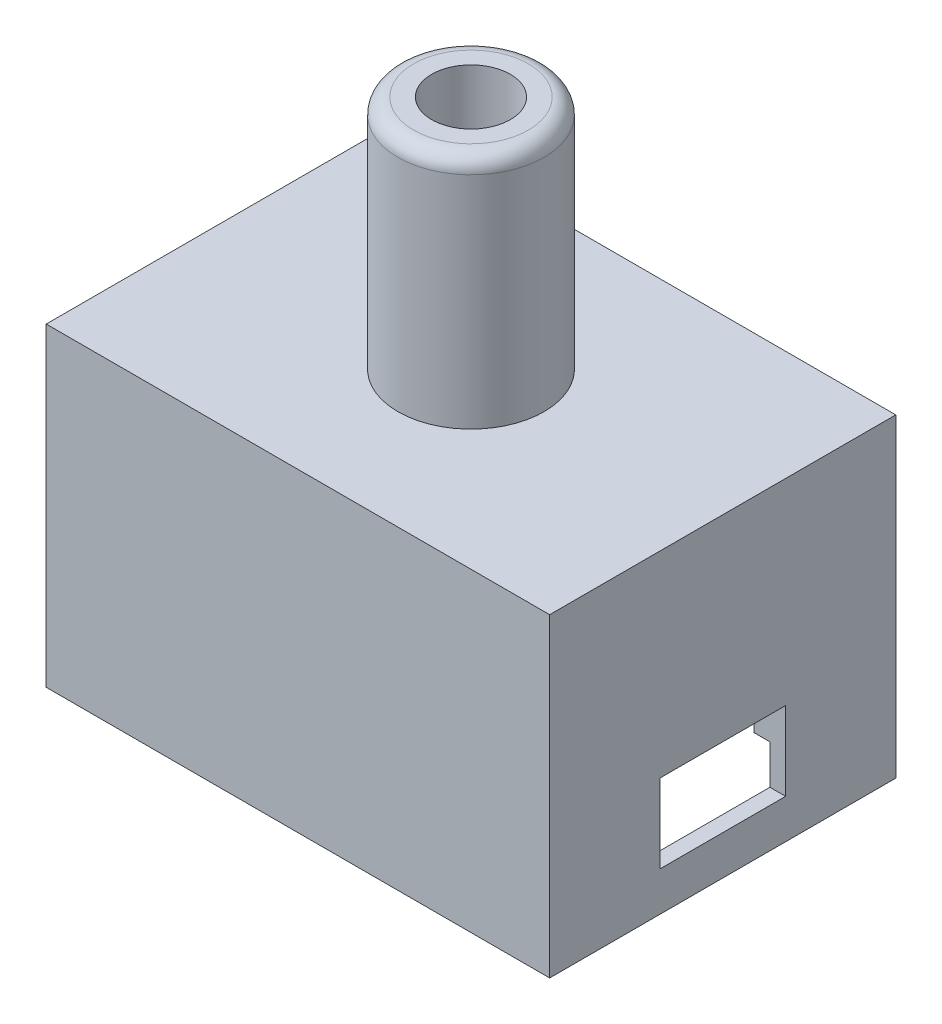
from build123d import *

# Parameters (mm, degrees)
SKETCH1_W           = 32
SKETCH1_H           = 22
BOSS_EXTRUDE1_DEPTH = 20
SKETCH2_R           = 4.65
BOSS_EXTRUDE2_DEPTH = 15
SKETCH3_W           = 30
SKETCH3_H           = 20
CUT_EXTRUDE1_DEPTH  = 19
SKETCH4_R           = 2.5
CUT_EXTRUDE2_DEPTH  = 28.166155414
FILLET1_R           = 1
FILLET2_R           = 1
SKETCH5_W           = 30
SKETCH5_H           = 20
SKETCH5_W_2         = 28
SKETCH5_H_2         = 18
BOSS_EXTRUDE3_DEPTH = 14
CUT_EXTRUDE3_REACH  = 50.683
SKETCH8_W           = 8
SKETCH8_H           = 5


with BuildPart() as part:
    # Sketch1 → Boss-Extrude1 (new body)
    with BuildSketch(Plane(origin=(0, 0, 0), x_dir=(1, 0, 0), z_dir=(0, 1, 0))):
        Rectangle(SKETCH1_W, SKETCH1_H)
    extrude(amount=BOSS_EXTRUDE1_DEPTH)

    # Sketch2 → Boss-Extrude2 (add)
    with BuildSketch(Plane(origin=(0, 20, 0), x_dir=(1, 0, 0), z_dir=(0, 1, 0))):
        with Locations(Location((0, 0, 0), (0, 0, 270))):
            Circle(SKETCH2_R)
    extrude(amount=BOSS_EXTRUDE2_DEPTH)

    # Sketch3 → Cut-Extrude1 (cut)
    with BuildSketch(Plane.XZ):
        Rectangle(SKETCH3_W, SKETCH3_H)
    extrude(amount=-CUT_EXTRUDE1_DEPTH, mode=Mode.SUBTRACT)

    # Sketch4 → Cut-Extrude2 (cut, through all)
    with BuildSketch(Plane.XZ.offset(-19)):
        with Locations(Location((0, 0, 0), (0, 0, 270))):
            Circle(SKETCH4_R)
    extrude(amount=-CUT_EXTRUDE2_DEPTH, mode=Mode.SUBTRACT)

    # Fillet1
    fillet1_edges = [part.edges().sort_by_distance(p)[0] for p in [
        (0, 35, -4.65),
    ]]
    fillet(fillet1_edges, radius=FILLET1_R)

    # Fillet2
    fillet2_edges = [part.edges().sort_by_distance(p)[0] for p in [
        (0, 19, 2.5),
    ]]
    fillet(fillet2_edges, radius=FILLET2_R)

    # Sketch5 → Boss-Extrude3 (add)
    with BuildSketch(Plane.XZ.offset(-19)):
        Rectangle(SKETCH5_W, SKETCH5_H)
        Rectangle(SKETCH5_W_2, SKETCH5_H_2, mode=Mode.SUBTRACT)
    extrude(amount=BOSS_EXTRUDE3_DEPTH)

    # Cut-Extrude3: up to this face of the body (flat: up to its plane)
    cut_extrude3_end = Plane(part.part.faces().sort_by_distance((14, 12, 0))[0])
    # Sketch8 → Cut-Extrude3 (cut, up to the picked face)
    with BuildSketch(Plane(origin=(16, 0, 0), x_dir=(0, 0, -1), z_dir=(1, 0, 0)), mode=Mode.PRIVATE) as cut_extrude3_sk1:
        with Locations((0, 5)):
            Rectangle(SKETCH8_W, SKETCH8_H)
    cut_extrude3_tool1 = split(extrude(cut_extrude3_sk1.sketch, amount=-CUT_EXTRUDE3_REACH, mode=Mode.PRIVATE), bisect_by=cut_extrude3_end, keep=Keep.BOTH, mode=Mode.PRIVATE)
    add(cut_extrude3_tool1.solids().sort_by(Axis((16, 5, 0), (-1, 0, 0)))[0], mode=Mode.SUBTRACT)


solid = part.part
